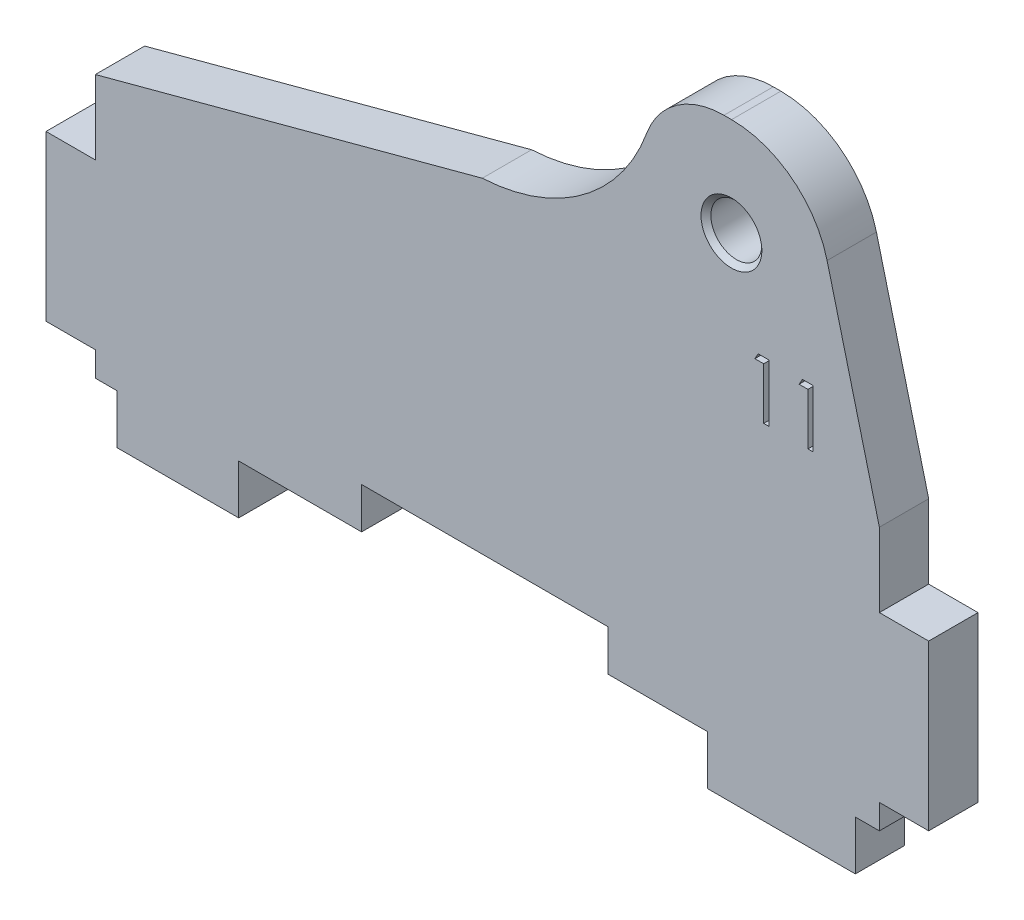
from build123d import *

# Parameters (mm, degrees)
SKETCH_1_R          = 1.55
EXTRUDE_1_DEPTH     = 3
CUT_EXTRUDE_1_DEPTH = 1
CHAMFER_1_SIZE      = 0.3


with BuildPart() as part:
    # 草图1 → 凸台-拉伸1 (new body)
    with BuildSketch(Plane(origin=(0, 0, 0), x_dir=(-1, 0, 0), z_dir=(0, 0, -1))):
        with BuildLine():
            Line((-47.519320255, 26.959319012), (-50.6992, 14.4996))
            Line((-50.6992, 14.4996), (-50.6992, 10.0003))
            Line((-50.6992, 10.0003), (-53.6992, 10.0003))
            Line((-53.6992, 10.0003), (-53.6992, 0))
            Line((-53.6992, 0), (-50.6992, 0))
            Line((-50.6992, 0), (-50.6992, -1.5007))
            Line((-50.6992, -1.5007), (-49.2382, -1.5007))
            Line((-49.2382, -1.5007), (-49.2382, -4.5007))
            Line((-49.2382, -4.5007), (-40.2392, -4.5007))
            Line((-40.2392, -4.5007), (-40.2392, -1.4993))
            Line((-40.2392, -1.4993), (-34.2002, -1.4993))
            Line((-34.2002, -1.4993), (-34.2002, 1.0005))
            Line((-34.2002, 1.0005), (-19.2003, 1.0005))
            Line((-19.2003, 1.0005), (-19.2003, -1.4993))
            Line((-19.2003, -1.4993), (-11.7217, -1.4993))
            Line((-11.7217, -1.4993), (-11.7217, -4.5007))
            Line((-11.7217, -4.5007), (-4.3215, -4.5007))
            Line((-4.3215, -4.5007), (-4.3215, -1.5007))
            Line((-4.3215, -1.5007), (-3, -1.5007))
            Line((-3, -1.5007), (-3, 0))
            Line((-3, 0), (0, 0))
            Line((0, 0), (0, 10.0003))
            Line((0, 10.0003), (-3, 10.0003))
            Line((-3, 10.0003), (-3, 14.4996))
            Line((-3, 14.4996), (-26.543543046, 20.807804388))
            ThreePointArc((-26.543543046, 20.807804388), (-32.65852857, 22.990550509), (-36.548909006, 28.188854909))
            ThreePointArc((-36.548909006, 28.188854909), (-38.379715818, 30.572322748), (-41.246222879, 31.4756))
            Line((-41.246222879, 31.4756), (-41.70566582, 31.4756))
            ThreePointArc((-41.70566582, 31.4756), (-45.386541118, 30.213865193), (-47.519320255, 26.959319012))
        make_face()
        with Locations(Location((-41.6992, 25.49975, 0), (0, 0, 180))):
            Circle(SKETCH_1_R, mode=Mode.SUBTRACT)
    extrude(amount=-EXTRUDE_1_DEPTH)

    # 草图2 → 切除-拉伸1 (cut)
    with BuildSketch(Plane.XY.offset(3)):
        Polygon((43.327916651, 19.948770062), (43.975052068, 19.948770062), (43.975052068, 16.448770062), (43.660949504, 16.448770062), (43.660949504, 19.589795703), (43.122487965, 19.589795703), align=None)
        Polygon((46.020224344, 19.948770062), (46.66735976, 19.948770062), (46.66735976, 16.448770062), (46.353257196, 16.448770062), (46.353257196, 19.589795703), (45.814795658, 19.589795703), align=None)
    extrude(amount=-CUT_EXTRUDE_1_DEPTH, mode=Mode.SUBTRACT)

    # 倒角1
    chamfer_1_edges = [part.edges().sort_by_distance(p)[0] for p in [
        (40.1492, 25.49975, 3),
        (40.1492, 25.49975, 0),
    ]]
    chamfer(chamfer_1_edges, length=CHAMFER_1_SIZE)


solid = part.part
